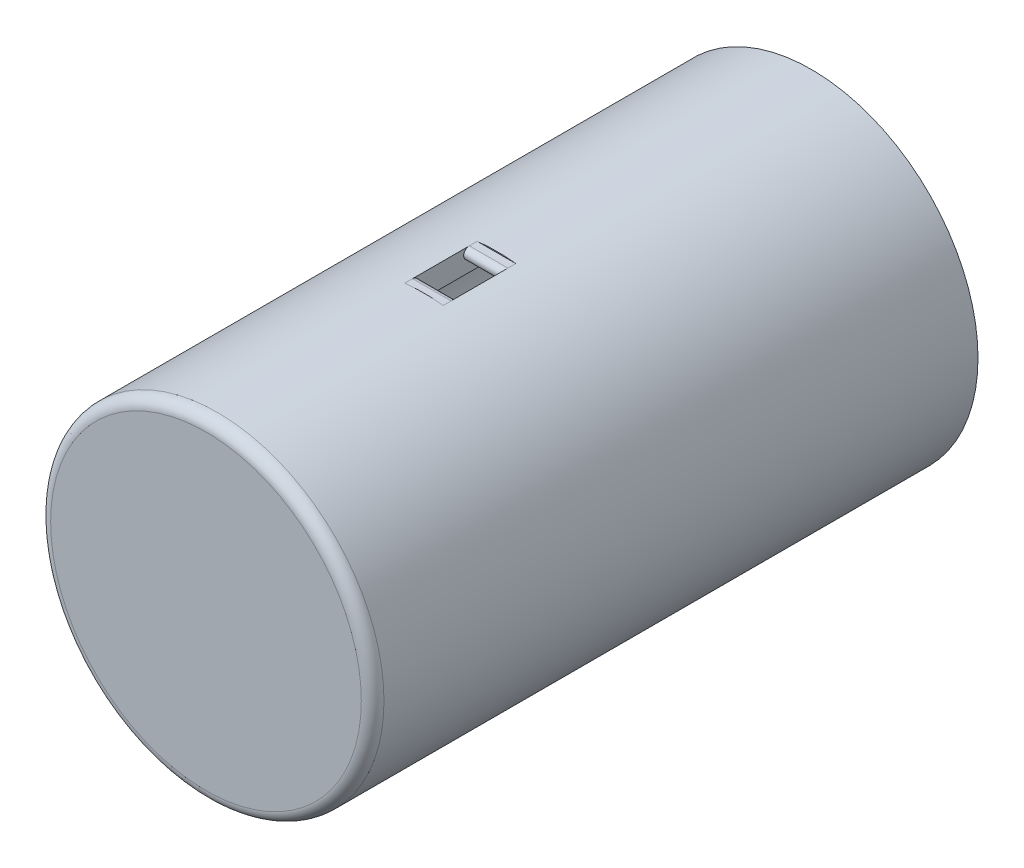
from build123d import *

# Parameters (mm, degrees)
SKETCH1_R               = 14.7
BOSS_EXTRUDE1_DEPTH     = 50
CUT_EXTRUDE1_REACH      = 56.15
SKETCH2_R               = 12.7
CUT_EXTRUDE2_REACH      = 60.88
CUT_EXTRUDE2_END_RADIUS = 12.7
SKETCH4_W               = 3.4
SKETCH4_H               = 50
SKETCH5_W               = 3.4
SKETCH5_H               = 6.4
CUT_EXTRUDE3_DEPTH      = 2
BOSS_EXTRUDE2_REACH     = 56.636
SKETCH7_W               = 3.4
SKETCH7_H               = 50
CUT_EXTRUDE4_DEPTH      = 0.114294
SKETCH8_W               = 3.4
SKETCH8_H               = 6.4
CUT_EXTRUDE5_DEPTH      = 2
BOSS_EXTRUDE3_REACH     = 56.636
SKETCH10_R              = 14.7
BOSS_EXTRUDE4_DEPTH     = 3.4
FILLET1_R               = 0.5
FILLET2_R               = 1


with BuildPart() as part:
    # Sketch1 → Boss-Extrude1 (new body)
    with BuildSketch(Plane(origin=(0, 0, 0), x_dir=(0, 1, 0), z_dir=(0, 0, 1))):
        with Locations(Location((0, 0, 0), (0, 0, 270))):
            Circle(SKETCH1_R)
    extrude(amount=BOSS_EXTRUDE1_DEPTH)

    # Sketch2 → Cut-Extrude1 (cut, up to next)
    with BuildSketch(Plane.XY.offset(50), mode=Mode.PRIVATE) as cut_extrude1_sk1:
        Circle(SKETCH2_R)
    cut_extrude1_tool1 = extrude(cut_extrude1_sk1.sketch, amount=-CUT_EXTRUDE1_REACH, mode=Mode.PRIVATE) & part.part
    add(cut_extrude1_tool1.solids().sort_by_distance((0, 0, 50))[0], mode=Mode.SUBTRACT)

    # Cut-Extrude2: up to this cylinder (the profile starts outside it)
    cut_extrude2_end = Plane(origin=(0, 0, 25), z_dir=(0, 0, 1)) * Cylinder(CUT_EXTRUDE2_END_RADIUS, 148.16, mode=Mode.PRIVATE)
    # Sketch4 → Cut-Extrude2 (cut, up to the surface)
    with BuildSketch(Plane(origin=(0, -12.7, 0), x_dir=(-1, 0, 0), z_dir=(0, 1, 0)), mode=Mode.PRIVATE) as cut_extrude2_sk1:
        with Locations((0, 25)):
            Rectangle(SKETCH4_W, SKETCH4_H)
    cut_extrude2_tool1 = extrude(cut_extrude2_sk1.sketch, amount=CUT_EXTRUDE2_REACH, mode=Mode.PRIVATE) - cut_extrude2_end
    add(cut_extrude2_tool1.solids().sort_by_distance((0, -12.7, 25))[0], mode=Mode.SUBTRACT)
    add(cut_extrude2_tool1.solids().sort_by_distance((0, -12.7, 25))[1], mode=Mode.SUBTRACT)

    # Sketch5 → Cut-Extrude3 (cut)
    with BuildSketch(Plane(origin=(0, -12.7, 0), x_dir=(-1, 0, 0), z_dir=(0, 1, 0))):
        with Locations((0, 30.973847717)):
            Rectangle(SKETCH5_W, SKETCH5_H)
    extrude(amount=-CUT_EXTRUDE3_DEPTH, mode=Mode.SUBTRACT)

    # Sketch6 → Boss-Extrude2 (add, up to next)
    with BuildSketch(Plane.YZ.offset(-1.7), mode=Mode.PRIVATE) as boss_extrude2_sk1:
        Polygon((-14.601369799, 27.773847717), (-12.7, 27.773847717), (-14.601369799, 29.675217516), align=None)
    boss_extrude2_tool1 = extrude(boss_extrude2_sk1.sketch, amount=BOSS_EXTRUDE2_REACH, mode=Mode.PRIVATE) - part.part
    # Sketch6 → Boss-Extrude2 (add, up to next)
    with BuildSketch(Plane.YZ.offset(-1.7), mode=Mode.PRIVATE) as boss_extrude2_sk2:
        Polygon((-14.601369799, 34.173847717), (-12.7, 34.173847717), (-14.601369799, 32.272477918), align=None)
    boss_extrude2_tool2 = extrude(boss_extrude2_sk2.sketch, amount=BOSS_EXTRUDE2_REACH, mode=Mode.PRIVATE) - part.part
    add(boss_extrude2_tool1.solids().sort_by_distance((-1.7, -13.96758, 28.407638))[0])
    add(boss_extrude2_tool2.solids().sort_by_distance((-1.7, -13.96758, 33.540058))[0])

    # Sketch7 → Cut-Extrude4 (cut)
    with BuildSketch(Plane.XZ.offset(-12.7)):
        with Locations((0, 25)):
            Rectangle(SKETCH7_W, SKETCH7_H)
    extrude(amount=CUT_EXTRUDE4_DEPTH, mode=Mode.SUBTRACT)

    # Sketch8 → Cut-Extrude5 (cut)
    with BuildSketch(Plane.XZ.offset(-12.7)):
        with Locations((0, 30.973847717)):
            Rectangle(SKETCH8_W, SKETCH8_H)
    extrude(amount=-CUT_EXTRUDE5_DEPTH, mode=Mode.SUBTRACT)

    # Sketch9 → Boss-Extrude3 (add, up to next)
    with BuildSketch(Plane.YZ.offset(-1.7), mode=Mode.PRIVATE) as boss_extrude3_sk1:
        Polygon((14.601369799, 34.173847717), (14.601369799, 32.272477918), (12.7, 34.173847717), align=None)
    boss_extrude3_tool1 = extrude(boss_extrude3_sk1.sketch, amount=BOSS_EXTRUDE3_REACH, mode=Mode.PRIVATE) - part.part
    # Sketch9 → Boss-Extrude3 (add, up to next)
    with BuildSketch(Plane.YZ.offset(-1.7), mode=Mode.PRIVATE) as boss_extrude3_sk2:
        Polygon((14.601369799, 27.773847717), (14.601369799, 29.675217516), (12.7, 27.773847717), align=None)
    boss_extrude3_tool2 = extrude(boss_extrude3_sk2.sketch, amount=BOSS_EXTRUDE3_REACH, mode=Mode.PRIVATE) - part.part
    add(boss_extrude3_tool1.solids().sort_by_distance((-1.7, 13.96758, 33.540058))[0])
    add(boss_extrude3_tool2.solids().sort_by_distance((-1.7, 13.96758, 28.407638))[0])

    # Sketch10 → Boss-Extrude4 (add)
    with BuildSketch(Plane.XY.offset(50)):
        Circle(SKETCH10_R)
    extrude(amount=BOSS_EXTRUDE4_DEPTH)

    # Fillet1
    fillet1_edges = [part.edges().sort_by_distance(p)[0] for p in [
        (0, 12.7, 27.773847717),
        (0, 12.7, 34.173847717),
        (0, 14.601369799, 32.272477918),
        (0, 14.601369799, 29.675217516),
        (0, -12.7, 27.773847717),
        (0, -12.7, 34.173847717),
        (0, -14.601369799, 29.675217516),
        (0, -14.601369799, 32.272477918),
    ]]
    fillet(fillet1_edges, radius=FILLET1_R)

    # Fillet2
    fillet2_edges = [part.edges().sort_by_distance(p)[0] for p in [
        (-14.7, 0, 53.4),
    ]]
    fillet(fillet2_edges, radius=FILLET2_R)


solid = part.part
